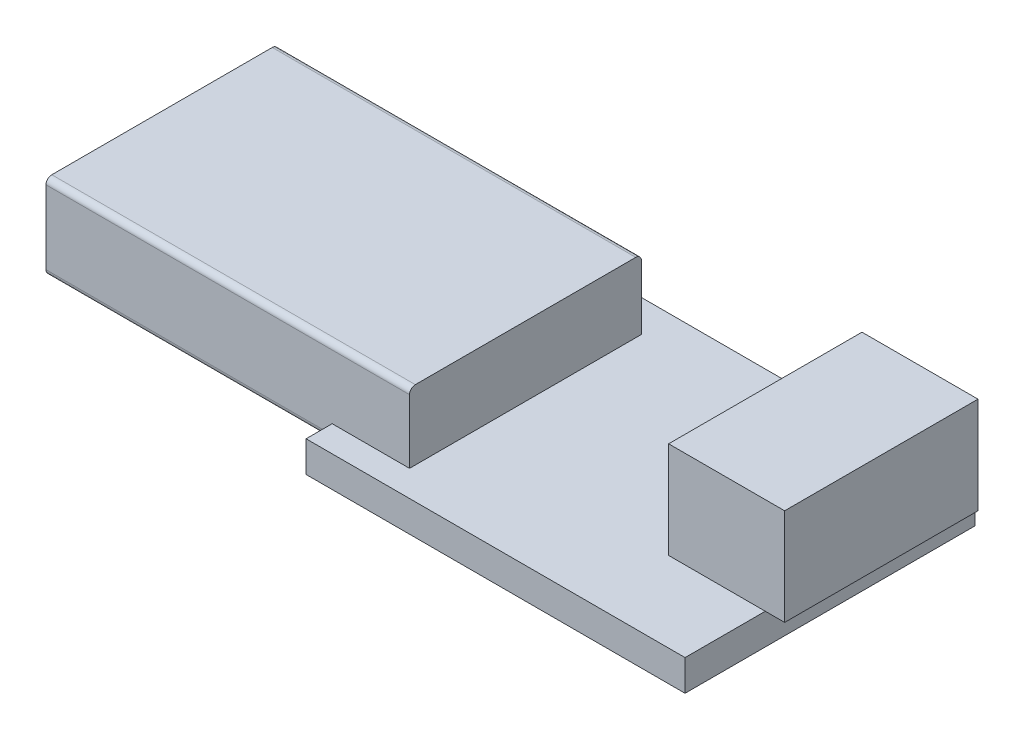
from build123d import *

# Parameters (mm, degrees)
SKETCH1_W           = 19.6
SKETCH1_H           = 15
BOSS_EXTRUDE1_DEPTH = 0.8
SKETCH2_W           = 18.8
SKETCH2_H           = 12
BOSS_EXTRUDE2_DEPTH = 4.4
SKETCH3_W           = 11.4
SKETCH3_H           = 3.8
CUT_EXTRUDE1_DEPTH  = 16.8
FILLET1_R           = 0.3
SKETCH4_W           = 6
SKETCH4_H           = 10
BOSS_EXTRUDE3_DEPTH = 5
BOSS_EXTRUDE4_DEPTH = 16.7


with BuildPart() as part:
    # Sketch1 → Boss-Extrude1 (new, symmetric)
    with BuildSketch(Plane(origin=(0, 0, 0), x_dir=(1, 0, 0), z_dir=(0, 1, 0))):
        Rectangle(SKETCH1_W, SKETCH1_H)
    extrude(amount=BOSS_EXTRUDE1_DEPTH, both=True)

    # Sketch2 → Boss-Extrude2 (add)
    with BuildSketch(Plane(origin=(0, 0, 0), x_dir=(1, 0, 0), z_dir=(0, 1, 0))):
        with Locations((-15.2, -0.15)):
            Rectangle(SKETCH2_W, SKETCH2_H)
    extrude(amount=BOSS_EXTRUDE2_DEPTH)

    # Sketch3 → Cut-Extrude1 (cut)
    with BuildSketch(Plane.ZY.offset(24.6)):
        with Locations((0.15, 2.2)):
            Rectangle(SKETCH3_W, SKETCH3_H)
    extrude(amount=-CUT_EXTRUDE1_DEPTH, mode=Mode.SUBTRACT)

    # Fillet1
    fillet1_edges = [part.edges().sort_by_distance(p)[0] for p in [
        (-17.2, 0, 6.15),
        (-17.2, 0, -5.85),
        (-15.2, 4.4, 6.15),
        (-15.2, 4.4, -5.85),
        (-16.2, 0.3, 5.85),
        (-16.2, 0.3, -5.55),
        (-16.2, 4.1, -5.55),
        (-16.2, 4.1, 5.85),
    ]]
    fillet(fillet1_edges, radius=FILLET1_R)

    # Sketch4 → Boss-Extrude3 (add)
    with BuildSketch(Plane(origin=(0, 0.8, 0), x_dir=(1, 0, 0), z_dir=(0, 1, 0))):
        with Locations((7.8, 1.65)):
            Rectangle(SKETCH4_W, SKETCH4_H)
    extrude(amount=BOSS_EXTRUDE3_DEPTH)

    # Sketch5 → Boss-Extrude4 (add)
    with BuildSketch(Plane.ZY.offset(7.8)):
        with BuildLine():
            Line((5.55, 0.3), (-5.25, 0.3))
            ThreePointArc((-5.25, 0.3), (-5.462132034, 0.387867966), (-5.55, 0.6))
            Line((-5.55, 0.6), (-5.55, 2.3))
            Line((-5.55, 2.3), (5.85, 2.3))
            Line((5.85, 2.3), (5.85, 0.6))
            ThreePointArc((5.85, 0.6), (5.762132034, 0.387867966), (5.55, 0.3))
        make_face()
    extrude(amount=BOSS_EXTRUDE4_DEPTH)


solid = part.part
